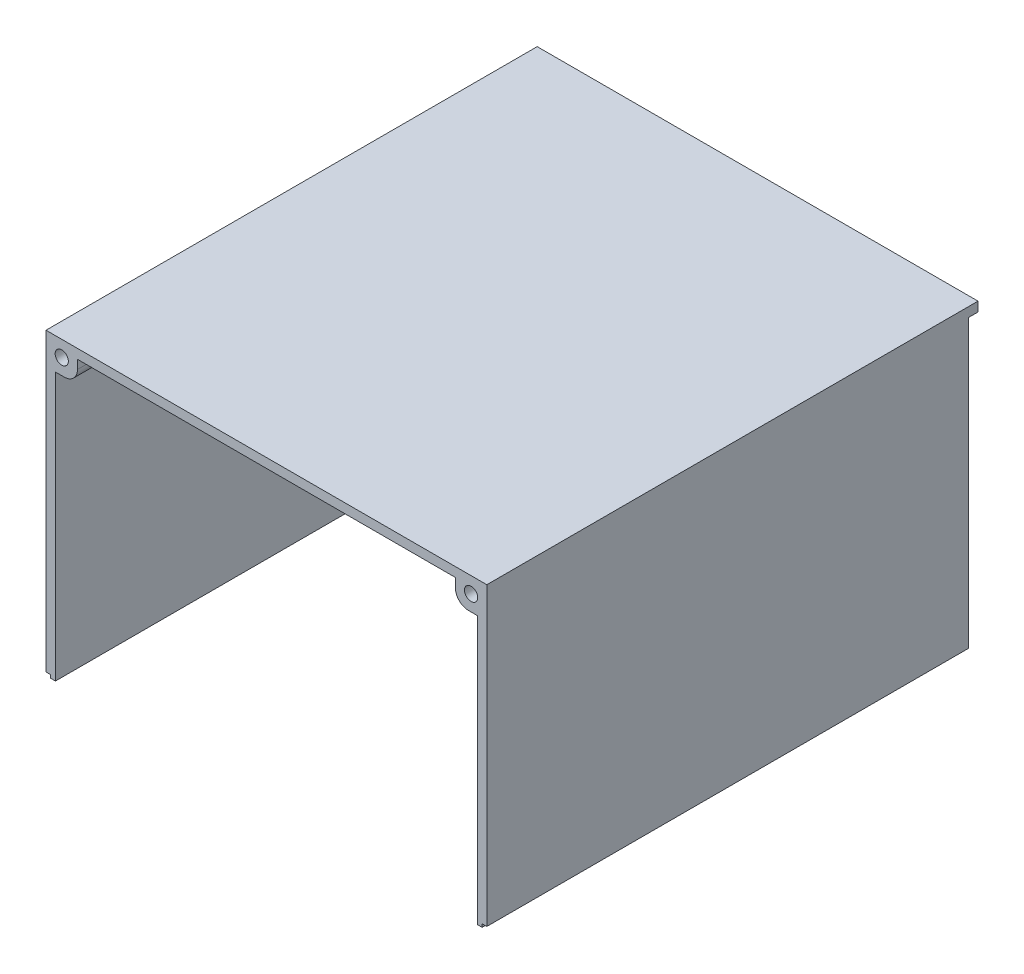
from build123d import *

# Parameters (mm, degrees)
EXTRUDE_1_DEPTH     = 153
EXTRUDE_2_DEPTH     = 1.5
SKETCH_3_W          = 140
SKETCH_3_H          = 3
EXTRUDE_3_DEPTH     = 1.5
EXTRUDE_4_DEPTH     = 8
SKETCH_5_R          = 2.1
CUT_EXTRUDE_1_DEPTH = 4.2


with BuildPart() as part:
    # Эскиз1 → Бобышка-Вытянуть1 (new body)
    with BuildSketch(Plane.XY):
        Polygon((-70, 1), (-70, 95), (70, 95), (70, 1), (68.5, 1), (68.5, 0), (67, 0), (67, 92), (-67, 92), (-67, 0), (-68.5, 0), (-68.5, 1), align=None)
    extrude(amount=EXTRUDE_1_DEPTH)

    # Эскиз2 → Бобышка-Вытянуть2 (add)
    with BuildSketch(Plane(origin=(0, 0, 0), x_dir=(-1, 0, 0), z_dir=(0, 0, -1))):
        Polygon((-70, 92), (-70, 95), (70, 95), (70, 93), (70, 92), (67, 92), (67, 93), (-67, 93), (-67, 92), align=None)
    extrude(amount=EXTRUDE_2_DEPTH)

    # Эскиз3 → Бобышка-Вытянуть3 (add)
    with BuildSketch(Plane(origin=(0, 0, -1.5), x_dir=(-1, 0, 0), z_dir=(0, 0, -1))):
        with Locations((0, 93.5)):
            Rectangle(SKETCH_3_W, SKETCH_3_H)
    extrude(amount=EXTRUDE_3_DEPTH)

    # Эскиз4 → Бобышка-Вытянуть4 (add)
    with BuildSketch(Plane.XY.offset(153)):
        with BuildLine():
            Line((-67, 92), (-60, 92))
            Line((-60, 92), (-60, 89.2))
            ThreePointArc((-60, 89.2), (-61.230151519, 86.230151519), (-64.2, 85))
            Line((-64.2, 85), (-67, 85))
            Line((-67, 85), (-67, 92))
        make_face()
        with BuildLine():
            Line((60, 92), (60, 89.2))
            ThreePointArc((60, 89.2), (61.230151519, 86.230151519), (64.2, 85))
            Line((64.2, 85), (67, 85))
            Line((67, 85), (67, 92))
            Line((67, 92), (60, 92))
        make_face()
    extrude(amount=-EXTRUDE_4_DEPTH)

    # Эскиз5 → Вырез-Вытянуть1 (cut)
    with BuildSketch(Plane.XY.offset(153)):
        with Locations((-65, 90)):
            Circle(SKETCH_5_R)
        with Locations(Location((65, 90, 0), (0, 0, 180))):
            Circle(SKETCH_5_R)
    extrude(amount=-CUT_EXTRUDE_1_DEPTH, mode=Mode.SUBTRACT)


solid = part.part
